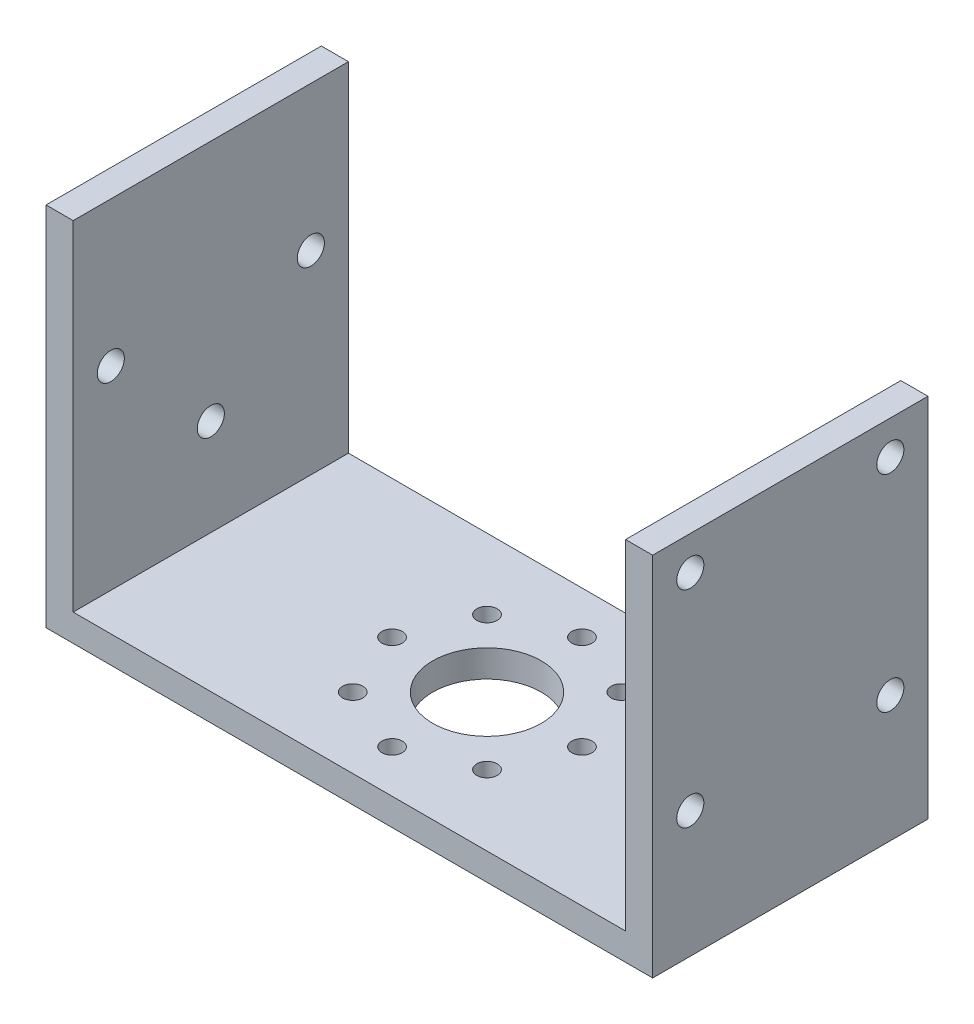
from build123d import *

# Parameters (mm, degrees)
SKETCH1_W               = 44.73
SKETCH1_H               = 20.3
YAWMOUNT_DEPTH          = 2
SKETCH2_W               = 2
SKETCH2_H               = 20.3
BODYCONNECTORS_DEPTH    = 25
SKETCH3_R               = 4
AXLE_COUNTERBORE_DEPTH  = 2
SKETCH5_R               = 0.75
AZEL_MOUNTSCREWS_DEPTH  = 2
SKETCH6_R               = 1
GEARSIDE_SCREWS_DEPTH   = 2
SKETCH7_R               = 1
SMOOTHSIDE_SCREWS_DEPTH = 2


with BuildPart() as part:
    # Sketch1 → YawMount (new body)
    with BuildSketch(Plane(origin=(0, 0, 0), x_dir=(1, 0, 0), z_dir=(0, 1, 0))):
        with Locations((22.365, 10.15)):
            Rectangle(SKETCH1_W, SKETCH1_H)
    extrude(amount=YAWMOUNT_DEPTH)

    # Sketch2 → BodyConnectors (add)
    with BuildSketch(Plane(origin=(0, 2, 0), x_dir=(1, 0, 0), z_dir=(0, 1, 0))):
        with Locations((1, 10.15)):
            Rectangle(SKETCH2_W, SKETCH2_H)
        with Locations((43.73, 10.15)):
            Rectangle(SKETCH2_W, SKETCH2_H)
    extrude(amount=BODYCONNECTORS_DEPTH)

    # Sketch3 → Axle-Counterbore (cut)
    with BuildSketch(Plane.XZ):
        with Locations(Location((22.365, -10.15, 0), (0, 0, 270))):
            Circle(SKETCH3_R)
    extrude(amount=-AXLE_COUNTERBORE_DEPTH, mode=Mode.SUBTRACT)

    # Sketch5 → azel-mountscrews (cut)
    with BuildSketch(Plane.XZ):
        with Locations(Location((15.365, -10.15, 0), (0, 0, 270))):
            Circle(SKETCH5_R)
        with Locations(Location((17.415252532, -5.200252532, 0), (0, 0, 270))):
            Circle(SKETCH5_R)
        with Locations(Location((22.365, -3.15, 0), (0, 0, 270))):
            Circle(SKETCH5_R)
        with Locations(Location((27.314747468, -5.200252532, 0), (0, 0, 270))):
            Circle(SKETCH5_R)
        with Locations(Location((29.365, -10.15, 0), (0, 0, 270))):
            Circle(SKETCH5_R)
        with Locations(Location((27.314747468, -15.099747468, 0), (0, 0, 270))):
            Circle(SKETCH5_R)
        with Locations(Location((22.365, -17.15, 0), (0, 0, 270))):
            Circle(SKETCH5_R)
        with Locations(Location((17.415252532, -15.099747468, 0), (0, 0, 270))):
            Circle(SKETCH5_R)
    extrude(amount=-AZEL_MOUNTSCREWS_DEPTH, mode=Mode.SUBTRACT)

    # Sketch6 → GearSide-Screws (cut)
    with BuildSketch(Plane(origin=(2, 0, 0), x_dir=(0, 0, -1), z_dir=(1, 0, 0))):
        with Locations((10.15, 9.12)):
            Circle(SKETCH6_R)
        with Locations((17.525, 16.33)):
            Circle(SKETCH6_R)
        with Locations((2.775, 16.33)):
            Circle(SKETCH6_R)
    extrude(amount=-GEARSIDE_SCREWS_DEPTH, mode=Mode.SUBTRACT)

    # Sketch7 → SmoothSide-Screws (cut)
    with BuildSketch(Plane.ZY.offset(-42.73)):
        with Locations((-2.775, 9.3)):
            Circle(SKETCH7_R)
        with Locations((-17.525, 9.3)):
            Circle(SKETCH7_R)
        with Locations((-17.525, 24.5)):
            Circle(SKETCH7_R)
        with Locations((-2.775, 24.5)):
            Circle(SKETCH7_R)
    extrude(amount=-SMOOTHSIDE_SCREWS_DEPTH, mode=Mode.SUBTRACT)


solid = part.part
